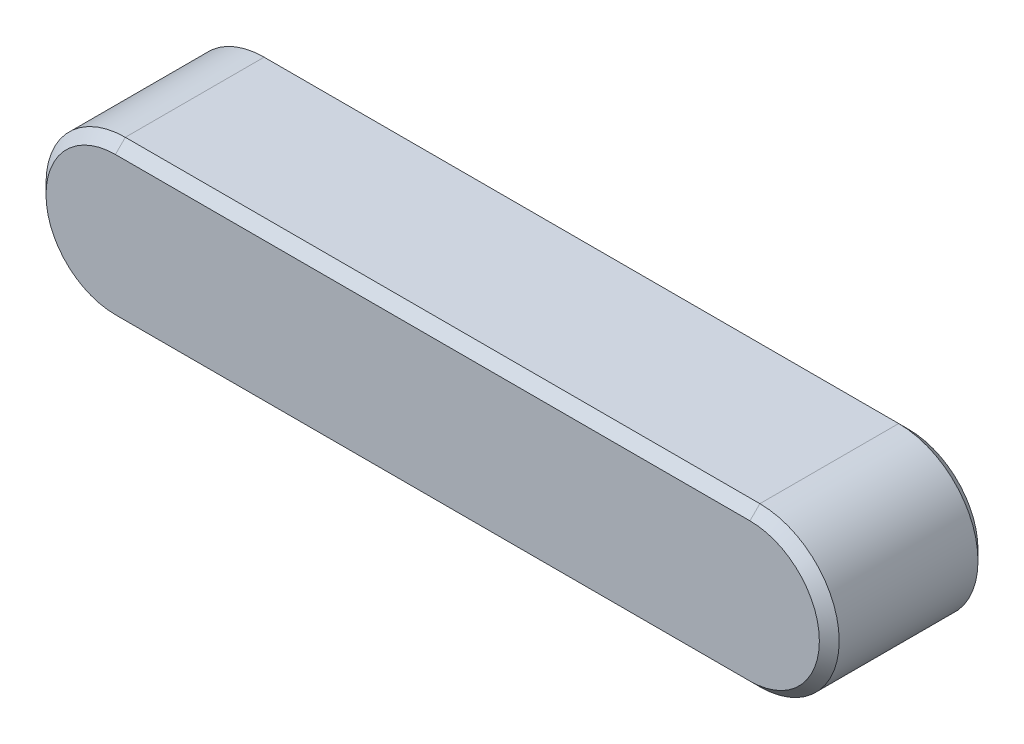
from build123d import *

# Parameters (mm, degrees)
BASEKEY_DEPTH = 2
CHAMFER1_SIZE = 0.25


with BuildPart() as part:
    # Sketch1 → BaseKey (new, symmetric)
    with BuildSketch(Plane.XY):
        with BuildLine():
            Line((-16, 2), (0, 2))
            ThreePointArc((0, 2), (2, 0), (0, -2))
            Line((0, -2), (-16, -2))
            ThreePointArc((-16, -2), (-18, 0), (-16, 2))
        make_face()
    extrude(amount=BASEKEY_DEPTH, both=True)

    # Chamfer1
    chamfer1_edges = [part.edges().sort_by_distance(p)[0] for p in [
        (2, 0, 2),
        (-8, 2, 2),
        (-18, 0, 2),
        (-8, 2, -2),
        (2, 0, -2),
        (-8, -2, -2),
        (-18, 0, -2),
        (-8, -2, 2),
    ]]
    chamfer(chamfer1_edges, length=CHAMFER1_SIZE)


solid = part.part
